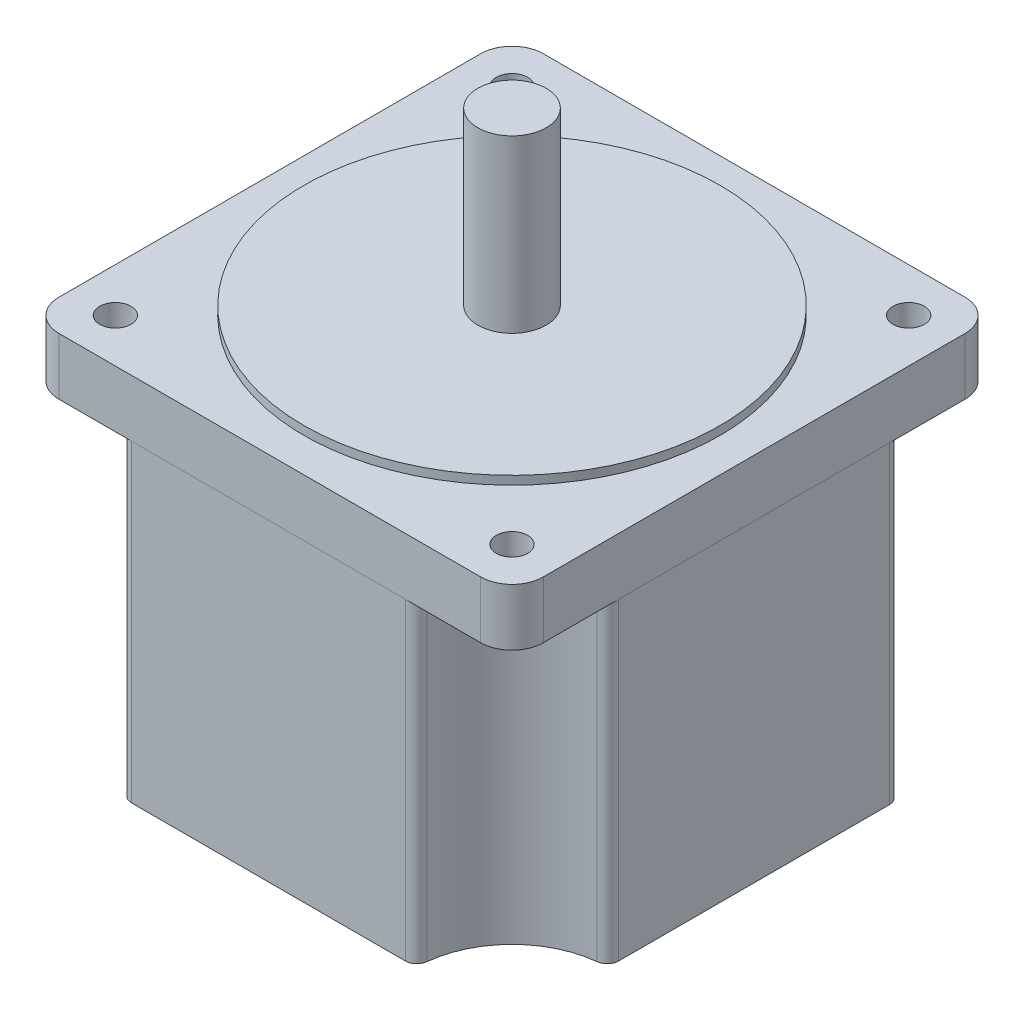
from build123d import *

# Parameters (mm, degrees)
SKETCH_1_R      = 2.75
EXTRUDE_1_DEPTH = 10
SKETCH_2_R      = 36.51
EXTRUDE_2_DEPTH = 1.5
SKETCH_3_R      = 6
EXTRUDE_3_DEPTH = 30
EXTRUDE_4_DEPTH = 55


with BuildPart() as part:
    # Эскиз1 → Вытянуть1 (new body)
    with BuildSketch(Plane(origin=(0, 0, 0), x_dir=(1, 0, 0), z_dir=(0, 1, 0))):
        with BuildLine():
            Line((-37, 42.5), (37, 42.5))
            ThreePointArc((37, 42.5), (40.889087297, 40.889087297), (42.5, 37))
            Line((42.5, 37), (42.5, -37))
            ThreePointArc((42.5, -37), (40.889087297, -40.889087297), (37, -42.5))
            Line((37, -42.5), (-37, -42.5))
            ThreePointArc((-37, -42.5), (-40.889087297, -40.889087297), (-42.5, -37))
            Line((-42.5, -37), (-42.5, 37))
            ThreePointArc((-42.5, 37), (-40.889087297, 40.889087297), (-37, 42.5))
        make_face()
        with Locations(Location((-34.8, 34.8, 0), (0, 0, 270))):
            Circle(SKETCH_1_R, mode=Mode.SUBTRACT)
        with Locations(Location((34.8, 34.8, 0), (0, 0, 90))):
            Circle(SKETCH_1_R, mode=Mode.SUBTRACT)
        with Locations(Location((34.8, -34.8, 0), (0, 0, 270))):
            Circle(SKETCH_1_R, mode=Mode.SUBTRACT)
        with Locations(Location((-34.8, -34.8, 0), (0, 0, 90))):
            Circle(SKETCH_1_R, mode=Mode.SUBTRACT)
    extrude(amount=EXTRUDE_1_DEPTH)

    # Эскиз2 → Вытянуть2 (add)
    with BuildSketch(Plane(origin=(0, 10, 0), x_dir=(1, 0, 0), z_dir=(0, 1, 0))):
        with Locations(Location((0, 0, 0), (0, 0, 90))):
            Circle(SKETCH_2_R)
    extrude(amount=EXTRUDE_2_DEPTH)

    # Эскиз3 → Вытянуть3 (add)
    with BuildSketch(Plane(origin=(0, 11.5, 0), x_dir=(1, 0, 0), z_dir=(0, 1, 0))):
        with Locations(Location((0, 0, 0), (0, 0, 270))):
            Circle(SKETCH_3_R)
    extrude(amount=EXTRUDE_3_DEPTH)

    # Эскиз4 → Вытянуть4 (add)
    with BuildSketch(Plane.XZ):
        with BuildLine():
            Line((-42.755134635, 23.986897935), (-42.755134635, -23.986897935))
            ThreePointArc((-42.755134635, -23.986897935), (-42.243466041, -25.322888065), (-40.970265008, -25.975294003))
            ThreePointArc((-40.970265008, -25.975294003), (-31.02184563, -30.739107233), (-26.258032399, -40.687526612))
            ThreePointArc((-26.258032399, -40.687526612), (-25.605626461, -41.960727645), (-24.269636331, -42.472396239))
            Line((-24.269636331, -42.472396239), (23.75936706, -42.472396239))
            ThreePointArc((23.75936706, -42.472396239), (25.09535719, -41.960727645), (25.747763128, -40.687526612))
            ThreePointArc((25.747763128, -40.687526612), (30.585250737, -30.585250737), (40.687526612, -25.747763128))
            ThreePointArc((40.687526612, -25.747763128), (41.960727645, -25.09535719), (42.472396239, -23.75936706))
            Line((42.472396239, -23.75936706), (42.472396239, 23.75936706))
            ThreePointArc((42.472396239, 23.75936706), (41.960727645, 25.09535719), (40.687526612, 25.747763128))
            ThreePointArc((40.687526612, 25.747763128), (30.585250737, 30.585250737), (25.747763128, 40.687526612))
            ThreePointArc((25.747763128, 40.687526612), (25.09535719, 41.960727645), (23.75936706, 42.472396239))
            Line((23.75936706, 42.472396239), (-24.269636331, 42.472396239))
            ThreePointArc((-24.269636331, 42.472396239), (-25.605626461, 41.960727645), (-26.258032399, 40.687526612))
            ThreePointArc((-26.258032399, 40.687526612), (-31.02184563, 30.739107233), (-40.970265008, 25.975294003))
            ThreePointArc((-40.970265008, 25.975294003), (-42.243466041, 25.322888065), (-42.755134635, 23.986897935))
        make_face()
    extrude(amount=EXTRUDE_4_DEPTH)


solid = part.part
